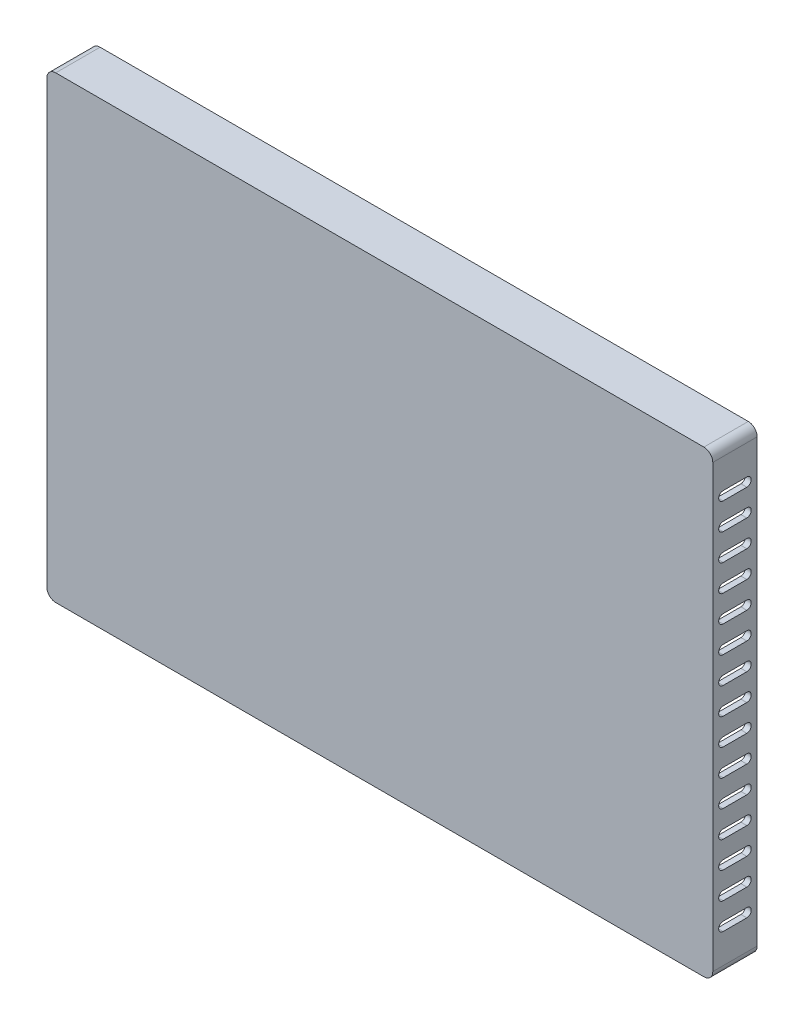
from build123d import *

# Parameters (mm, degrees)
SKETCH_1_W          = 225
SKETCH_1_H          = 155
EXTRUDE_1_DEPTH     = 15
FILLET_1_R          = 3
SHELL_1_T           = -2
EXTRUDE_2_DEPTH     = 0.5
CUT_EXTRUDE_1_DEPTH = 3


with BuildPart() as part:
    # 草图1 → 凸台-拉伸1 (new body)
    with BuildSketch(Plane.XY):
        with Locations((112.5, -77.5)):
            Rectangle(SKETCH_1_W, SKETCH_1_H)
    extrude(amount=EXTRUDE_1_DEPTH)

    # 圆角1
    fillet_1_edges = [part.edges().sort_by_distance(p)[0] for p in [
        (0, 0, 7.5),
        (225, 0, 7.5),
        (225, -155, 7.5),
        (0, -155, 7.5),
    ]]
    fillet(fillet_1_edges, radius=FILLET_1_R)

    # 抽壳1
    shell_1_openings = [part.faces().sort_by_distance(p)[0] for p in [
        (112.5, -77.5, 0),
    ]]
    offset(amount=SHELL_1_T, openings=shell_1_openings, kind=Kind.INTERSECTION)

    # 草图4 → 凸台-拉伸2 (add)
    with BuildSketch(Plane(origin=(0, 0, 0), x_dir=(-1, 0, 0), z_dir=(0, 0, -1))):
        with BuildLine():
            Line((-223.8, -3), (-223.8, -152))
            ThreePointArc((-223.8, -152), (-223.272792206, -153.272792206), (-222, -153.8))
            Line((-222, -153.8), (-3, -153.8))
            ThreePointArc((-3, -153.8), (-1.727207794, -153.272792206), (-1.2, -152))
            Line((-1.2, -152), (-1.2, -3))
            ThreePointArc((-1.2, -3), (-1.727207794, -1.727207794), (-3, -1.2))
            Line((-3, -1.2), (-222, -1.2))
            ThreePointArc((-222, -1.2), (-223.272792206, -1.727207794), (-223.8, -3))
        make_face()
        with BuildLine():
            Line((-223, -3), (-223, -152))
            ThreePointArc((-223, -152), (-222.707106781, -152.707106781), (-222, -153))
            Line((-222, -153), (-3, -153))
            ThreePointArc((-3, -153), (-2.292893219, -152.707106781), (-2, -152))
            Line((-2, -152), (-2, -3))
            ThreePointArc((-2, -3), (-2.292893219, -2.292893219), (-3, -2))
            Line((-3, -2), (-222, -2))
            ThreePointArc((-222, -2), (-222.707106781, -2.292893219), (-223, -3))
        make_face(mode=Mode.SUBTRACT)
    extrude(amount=EXTRUDE_2_DEPTH)

    # 草图5 → 切除-拉伸1 (cut)
    with BuildSketch(Plane.ZY):
        with BuildLine():
            Line((3.5, -13), (11.5, -13))
            ThreePointArc((11.5, -13), (13, -14.5), (11.5, -16))
            Line((11.5, -16), (3.5, -16))
            ThreePointArc((3.5, -16), (2, -14.5), (3.5, -13))
        make_face()
        with BuildLine():
            Line((3.5, -22), (11.5, -22))
            ThreePointArc((11.5, -22), (13, -23.5), (11.5, -25))
            Line((11.5, -25), (3.5, -25))
            ThreePointArc((3.5, -25), (2, -23.5), (3.5, -22))
        make_face()
        with BuildLine():
            Line((3.5, -31), (11.5, -31))
            ThreePointArc((11.5, -31), (13, -32.5), (11.5, -34))
            Line((11.5, -34), (3.5, -34))
            ThreePointArc((3.5, -34), (2, -32.5), (3.5, -31))
        make_face()
        with BuildLine():
            Line((3.5, -40), (11.5, -40))
            ThreePointArc((11.5, -40), (13, -41.5), (11.5, -43))
            Line((11.5, -43), (3.5, -43))
            ThreePointArc((3.5, -43), (2, -41.5), (3.5, -40))
        make_face()
        with BuildLine():
            Line((3.5, -49), (11.5, -49))
            ThreePointArc((11.5, -49), (13, -50.5), (11.5, -52))
            Line((11.5, -52), (3.5, -52))
            ThreePointArc((3.5, -52), (2, -50.5), (3.5, -49))
        make_face()
        with BuildLine():
            Line((3.5, -58), (11.5, -58))
            ThreePointArc((11.5, -58), (13, -59.5), (11.5, -61))
            Line((11.5, -61), (3.5, -61))
            ThreePointArc((3.5, -61), (2, -59.5), (3.5, -58))
        make_face()
        with BuildLine():
            Line((3.5, -67), (11.5, -67))
            ThreePointArc((11.5, -67), (13, -68.5), (11.5, -70))
            Line((11.5, -70), (3.5, -70))
            ThreePointArc((3.5, -70), (2, -68.5), (3.5, -67))
        make_face()
        with BuildLine():
            Line((3.5, -76), (11.5, -76))
            ThreePointArc((11.5, -76), (13, -77.5), (11.5, -79))
            Line((11.5, -79), (3.5, -79))
            ThreePointArc((3.5, -79), (2, -77.5), (3.5, -76))
        make_face()
        with BuildLine():
            Line((3.5, -85), (11.5, -85))
            ThreePointArc((11.5, -85), (13, -86.5), (11.5, -88))
            Line((11.5, -88), (3.5, -88))
            ThreePointArc((3.5, -88), (2, -86.5), (3.5, -85))
        make_face()
        with BuildLine():
            Line((3.5, -94), (11.5, -94))
            ThreePointArc((11.5, -94), (13, -95.5), (11.5, -97))
            Line((11.5, -97), (3.5, -97))
            ThreePointArc((3.5, -97), (2, -95.5), (3.5, -94))
        make_face()
        with BuildLine():
            Line((3.5, -103), (11.5, -103))
            ThreePointArc((11.5, -103), (13, -104.5), (11.5, -106))
            Line((11.5, -106), (3.5, -106))
            ThreePointArc((3.5, -106), (2, -104.5), (3.5, -103))
        make_face()
        with BuildLine():
            Line((3.5, -112), (11.5, -112))
            ThreePointArc((11.5, -112), (13, -113.5), (11.5, -115))
            Line((11.5, -115), (3.5, -115))
            ThreePointArc((3.5, -115), (2, -113.5), (3.5, -112))
        make_face()
        with BuildLine():
            Line((3.5, -121), (11.5, -121))
            ThreePointArc((11.5, -121), (13, -122.5), (11.5, -124))
            Line((11.5, -124), (3.5, -124))
            ThreePointArc((3.5, -124), (2, -122.5), (3.5, -121))
        make_face()
        with BuildLine():
            Line((3.5, -130), (11.5, -130))
            ThreePointArc((11.5, -130), (13, -131.5), (11.5, -133))
            Line((11.5, -133), (3.5, -133))
            ThreePointArc((3.5, -133), (2, -131.5), (3.5, -130))
        make_face()
        with BuildLine():
            Line((3.5, -139), (11.5, -139))
            ThreePointArc((11.5, -139), (13, -140.5), (11.5, -142))
            Line((11.5, -142), (3.5, -142))
            ThreePointArc((3.5, -142), (2, -140.5), (3.5, -139))
        make_face()
    cut_extrude_1 = extrude(amount=-CUT_EXTRUDE_1_DEPTH, mode=Mode.SUBTRACT)

    # 镜向1: 切除-拉伸1 across plane
    add(cut_extrude_1.mirror(Plane(origin=(112.5, 0, 0), x_dir=(0, 0, 1), z_dir=(1, 0, 0))), mode=Mode.SUBTRACT)


solid = part.part
